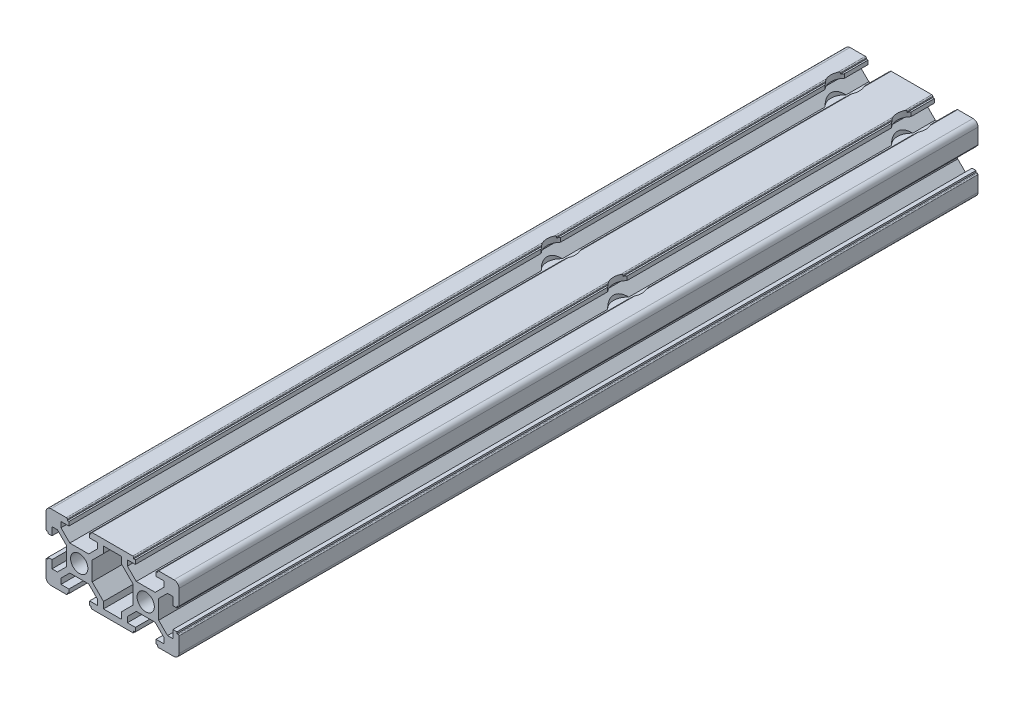
from build123d import *

# Parameters (mm, degrees)
SKETCH_1_R               = 2.6
EXTRUDE_1_DEPTH          = 120.2
FILLET_1_R               = 1.5
FILLET_2_R               = 0.3
CUT_EXTRUDE_1_DEPTH      = 123.642773941
CUT_EXTRUDE_1_DEPTH_BACK = 123.642773941
SKETCH_3_R               = 2.1
SKETCH_4_R               = 4.25
CUT_EXTRUDE_2_DEPTH      = 123.642774039


with BuildPart() as part:
    # 草图1 → 凸台-拉伸1 (new, symmetric)
    with BuildSketch(Plane.XY):
        Polygon((-13.9, 0), (-13.9, 2.839339828), (-16.560660172, 5.5), (-18.2, 5.5), (-18.2, 3.1), (-19.4, 3.1), (-19.4, 3.6), (-20, 3.6), (-20, 10), (-13.6, 10), (-13.6, 9.4), (-13.1, 9.4), (-13.1, 8.2), (-15.5, 8.2), (-15.5, 6.560660172), (-12.839339828, 3.9), (-7.160660172, 3.9), (-4.5, 6.560660172), (-4.5, 8.2), (-6.9, 8.2), (-6.9, 9.4), (-6.4, 9.4), (-6.4, 10), (6.4, 10), (6.4, 9.4), (6.9, 9.4), (6.9, 8.2), (4.5, 8.2), (4.5, 6.560660172), (7.160660172, 3.9), (12.839339828, 3.9), (15.5, 6.560660172), (15.5, 8.2), (13.1, 8.2), (13.1, 9.4), (13.6, 9.4), (13.6, 10), (20, 10), (20, 3.6), (19.4, 3.6), (19.4, 3.1), (18.2, 3.1), (18.2, 5.5), (16.560660172, 5.5), (13.9, 2.839339828), (13.9, 0), (13.9, -2.839339828), (16.560660172, -5.5), (18.2, -5.5), (18.2, -3.1), (19.4, -3.1), (19.4, -3.6), (20, -3.6), (20, -10), (13.6, -10), (13.6, -9.4), (13.1, -9.4), (13.1, -8.2), (15.5, -8.2), (15.5, -6.560660172), (12.839339828, -3.9), (7.160660172, -3.9), (4.5, -6.560660172), (4.5, -8.2), (6.9, -8.2), (6.9, -9.4), (6.4, -9.4), (6.4, -10), (-6.4, -10), (-6.4, -9.4), (-6.9, -9.4), (-6.9, -8.2), (-4.5, -8.2), (-4.5, -6.560660172), (-7.160660172, -3.9), (-12.839339828, -3.9), (-15.5, -6.560660172), (-15.5, -8.2), (-13.1, -8.2), (-13.1, -9.4), (-13.6, -9.4), (-13.6, -10), (-20, -10), (-20, -3.6), (-19.4, -3.6), (-19.4, -3.1), (-18.2, -3.1), (-18.2, -5.5), (-16.560660172, -5.5), (-13.9, -2.839339828), align=None)
        with Locations((-10, 0)):
            Circle(SKETCH_1_R, mode=Mode.SUBTRACT)
        with Locations(Location((10, 0, 0), (0, 0, 180))):
            Circle(SKETCH_1_R, mode=Mode.SUBTRACT)
        Polygon((-6.1, -2.839339828), (-6.1, 2.839339828), (-2.7, 6.239339828), (-2.7, 8.2), (2.7, 8.2), (2.7, 6.239339828), (6.1, 2.839339828), (6.1, -2.839339828), (2.7, -6.239339828), (2.7, -8.2), (-2.7, -8.2), (-2.7, -6.239339828), align=None, mode=Mode.SUBTRACT)
    extrude(amount=EXTRUDE_1_DEPTH, both=True)

    # 圆角1
    fillet_1_edges = [part.edges().sort_by_distance(p)[0] for p in [
        (-20, 10, 0),
        (20, 10, 0),
        (20, -10, 0),
        (-20, -10, 0),
    ]]
    fillet(fillet_1_edges, radius=FILLET_1_R)

    # 圆角2
    fillet_2_edges = [part.edges().sort_by_distance(p)[0] for p in [
        (-20, 3.6, 0),
        (-13.6, 10, 0),
        (-6.4, 10, 0),
        (6.4, 10, 0),
        (13.6, 10, 0),
        (20, 3.6, 0),
        (20, -3.6, 0),
        (13.6, -10, 0),
        (6.4, -10, 0),
        (-6.4, -10, 0),
        (-13.6, -10, 0),
        (-20, -3.6, 0),
    ]]
    fillet(fillet_2_edges, radius=FILLET_2_R)

    # 草图3 → 切除-拉伸1 (cut, two sides: drawn at the far end of the back side and taken through both)
    with BuildSketch(Plane.XZ.offset(3.9).offset(-CUT_EXTRUDE_1_DEPTH_BACK)):
        with Locations(Location((-10, -110.2, 0), (0, 0, 270))):
            Circle(SKETCH_3_R)
        with Locations(Location((10, -110.2, 0), (0, 0, 270))):
            Circle(SKETCH_3_R)
        with Locations(Location((-10, -24.8, 0), (0, 0, 270))):
            Circle(SKETCH_3_R)
        with Locations(Location((10, -24.8, 0), (0, 0, 270))):
            Circle(SKETCH_3_R)
    extrude(amount=CUT_EXTRUDE_1_DEPTH + CUT_EXTRUDE_1_DEPTH_BACK, mode=Mode.SUBTRACT)

    # 草图4 → 切除-拉伸2 (cut, through all)
    with BuildSketch(Plane(origin=(0, 3.9, 0), x_dir=(1, 0, 0), z_dir=(0, 1, 0))):
        with Locations((-10, 110.2)):
            Circle(SKETCH_4_R)
        with Locations((10, 110.2)):
            Circle(SKETCH_4_R)
        with Locations((-10, 24.8)):
            Circle(SKETCH_4_R)
        with Locations((10, 24.8)):
            Circle(SKETCH_4_R)
    extrude(amount=CUT_EXTRUDE_2_DEPTH, mode=Mode.SUBTRACT)


solid = part.part
